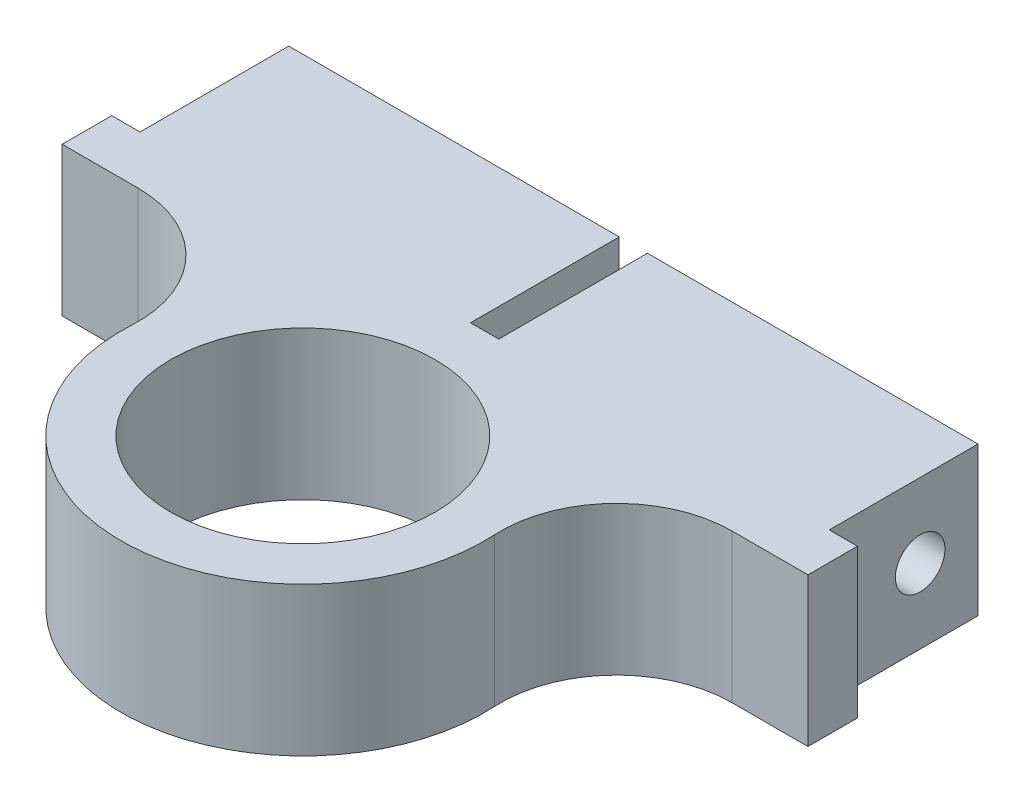
from build123d import *
from build123d.topology import SkipClean

# Parameters (mm, degrees)
SKETCH1_R           = 11
SKETCH1_R_2         = 8
SKETCH1_W           = 45.13
SKETCH1_H           = 7
BOSS_EXTRUDE1_DEPTH = 10
FILLET1_R           = 7
SKETCH2_W           = 1.71
SKETCH2_H           = 4
CUT_EXTRUDE1_DEPTH  = 10
SKETCH3_W           = 20
SKETCH3_H           = 10
BOSS_EXTRUDE2_DEPTH = 3
CUT_EXTRUDE2_START  = -3
CUT_EXTRUDE2_DEPTH  = 3
SKETCH6_W           = 20
SKETCH6_H           = 7
BOSS_EXTRUDE3_DEPTH = 2
SKETCH7_R           = 1.5
CUT_EXTRUDE5_DEPTH  = 44
SKETCH8_R           = 8
BOSS_EXTRUDE4_DEPTH = 1
BOSS_EXTRUDE5_START = 1
SKETCH9_R           = 8
BOSS_EXTRUDE5_DEPTH = 1


with BuildPart() as part:
    # Sketch1 → Boss-Extrude1 (new body)
    # profile 1 of 2: a face of its own
    with BuildSketch(Plane(origin=(0, 0, 0), x_dir=(1, 0, 0), z_dir=(0, 1, 0))):
        with Locations((22.565, -8)):
            Circle(SKETCH1_R)
        with Locations(Location((22.565, -8, 0), (0, 0, 270))):
            Circle(SKETCH1_R_2, mode=Mode.SUBTRACT)
    # profile 2 of 2: a face of its own
    with BuildSketch(Plane(origin=(0, 0, 0), x_dir=(1, 0, 0), z_dir=(0, 1, 0))):
        with Locations((22.565, 3.5)):
            Rectangle(SKETCH1_W, SKETCH1_H)
    extrude(amount=BOSS_EXTRUDE1_DEPTH)

    # Fillet1
    fillet1_edges = [part.edges().sort_by_distance(p)[0] for p in [
        (30.114834435, 5, 0),
        (15.015165565, 5, 0),
    ]]
    fillet(fillet1_edges, radius=FILLET1_R)

    # Sketch2 → Cut-Extrude1 (cut)
    with BuildSketch(Plane(origin=(0, 10, 0), x_dir=(1, 0, 0), z_dir=(0, 1, 0))):
        with Locations((0.855, 5)):
            Rectangle(SKETCH2_W, SKETCH2_H)
        with Locations((22.565, 5)):
            Rectangle(SKETCH2_W, SKETCH2_H)
        with Locations((44.275, 5)):
            Rectangle(SKETCH2_W, SKETCH2_H)
    extrude(amount=-CUT_EXTRUDE1_DEPTH, mode=Mode.SUBTRACT)

    # Sketch3 → Boss-Extrude2 (add)
    with BuildSketch(Plane(origin=(0, 0, -7), x_dir=(-1, 0, 0), z_dir=(0, 0, -1))):
        with Locations((-33.42, 5)):
            Rectangle(SKETCH3_W, SKETCH3_H)
        with Locations((-11.71, 5)):
            Rectangle(SKETCH3_W, SKETCH3_H)
    extrude(amount=BOSS_EXTRUDE2_DEPTH)

    # Sketch4 → Cut-Extrude2 (cut)
    with BuildSketch(Plane(origin=(0, 10, 0), x_dir=(1, 0, 0), z_dir=(0, 1, 0)).offset(CUT_EXTRUDE2_START)):
        with BuildLine():
            Line((21.71, 3), (21.71, 10))
            Line((21.71, 10), (1.71, 10))
            Line((1.71, 10), (1.71, 3))
            Line((1.71, 3), (0, 3))
            Line((0, 3), (0, 0))
            Line((0, 0), (4.592799244, 0))
            ThreePointArc((4.592799244, 0), (9.678181345, -2.189710103), (11.581988427, -7.388888889))
            ThreePointArc((11.581988427, -7.388888889), (22.565, -19), (33.548011573, -7.388888889))
            ThreePointArc((33.548011573, -7.388888889), (35.451818655, -2.189710103), (40.537200756, 0))
            Line((40.537200756, 0), (45.13, 0))
            Line((45.13, 0), (45.13, 3))
            Line((45.13, 3), (43.42, 3))
            Line((43.42, 3), (43.42, 10))
            Line((43.42, 10), (23.42, 10))
            Line((23.42, 10), (23.42, 3))
            Line((23.42, 3), (21.71, 3))
        make_face()
    extrude(amount=CUT_EXTRUDE2_DEPTH, mode=Mode.SUBTRACT)

    # Sketch6 → Boss-Extrude3 (add)
    with BuildSketch(Plane(origin=(0, 0, -10), x_dir=(-1, 0, 0), z_dir=(0, 0, -1))):
        with Locations((-33.42, 3.5)):
            Rectangle(SKETCH6_W, SKETCH6_H)
        with Locations((-11.71, 3.5)):
            Rectangle(SKETCH6_W, SKETCH6_H)
    extrude(amount=BOSS_EXTRUDE3_DEPTH)

    # Sketch7 → Cut-Extrude5 (cut)
    with BuildSketch(Plane.ZY.offset(-1.71)):
        with Locations((-8.5, 3.5)):
            Circle(SKETCH7_R)
    extrude(amount=-CUT_EXTRUDE5_DEPTH, mode=Mode.SUBTRACT)

    # Sketch8 → Boss-Extrude4 (add)
    with BuildSketch(Plane(origin=(0, 7, 0), x_dir=(1, 0, 0), z_dir=(0, 1, 0))):
        with BuildLine():
            Line((23.42, 3), (21.71, 3))
            Line((21.71, 3), (21.71, 12))
            Line((21.71, 12), (1.71, 12))
            Line((1.71, 12), (1.71, 3))
            Line((1.71, 3), (0, 3))
            Line((0, 3), (0, 0))
            Line((0, 0), (4.592799244, 0))
            ThreePointArc((4.592799244, 0), (9.678181345, -2.189710103), (11.581988427, -7.388888889))
            ThreePointArc((11.581988427, -7.388888889), (22.565, -19), (33.548011573, -7.388888889))
            ThreePointArc((33.548011573, -7.388888889), (35.451818655, -2.189710103), (40.537200756, 0))
            Line((40.537200756, 0), (45.13, 0))
            Line((45.13, 0), (45.13, 3))
            Line((45.13, 3), (43.42, 3))
            Line((43.42, 3), (43.42, 12))
            Line((43.42, 12), (23.42, 12))
            Line((23.42, 12), (23.42, 3))
        make_face()
        with Locations(Location((22.565, -8, 0), (0, 0, 270))):
            Circle(SKETCH8_R, mode=Mode.SUBTRACT)
    extrude(amount=BOSS_EXTRUDE4_DEPTH)

    # Sketch9 → Boss-Extrude5 (add)
    with SkipClean():  # the faces are left unmerged after this step: merging them gives an invalid solid
        with BuildSketch(Plane.XZ.offset(BOSS_EXTRUDE5_START)):
            with BuildLine():
                Line((1.71, -3), (1.71, -12))
                Line((1.71, -12), (21.71, -12))
                Line((21.71, -12), (21.71, -3))
                Line((21.71, -3), (23.42, -3))
                Line((23.42, -3), (23.42, -12))
                Line((23.42, -12), (43.42, -12))
                Line((43.42, -12), (43.42, -3))
                Line((43.42, -3), (45.13, -3))
                Line((45.13, -3), (45.13, 0))
                Line((45.13, 0), (40.537200756, 0))
                ThreePointArc((40.537200756, 0), (35.451818655, 2.189710103), (33.548011573, 7.388888889))
                ThreePointArc((33.548011573, 7.388888889), (22.565, 19), (11.581988427, 7.388888889))
                ThreePointArc((11.581988427, 7.388888889), (9.678181345, 2.189710103), (4.592799244, 0))
                Line((4.592799244, 0), (0, 0))
                Line((0, 0), (0, -3))
                Line((0, -3), (1.71, -3))
            make_face()
            with Locations(Location((22.565, 8, 0), (0, 0, 270))):
                Circle(SKETCH9_R, mode=Mode.SUBTRACT)
        extrude(amount=-BOSS_EXTRUDE5_DEPTH)


solid = part.part
